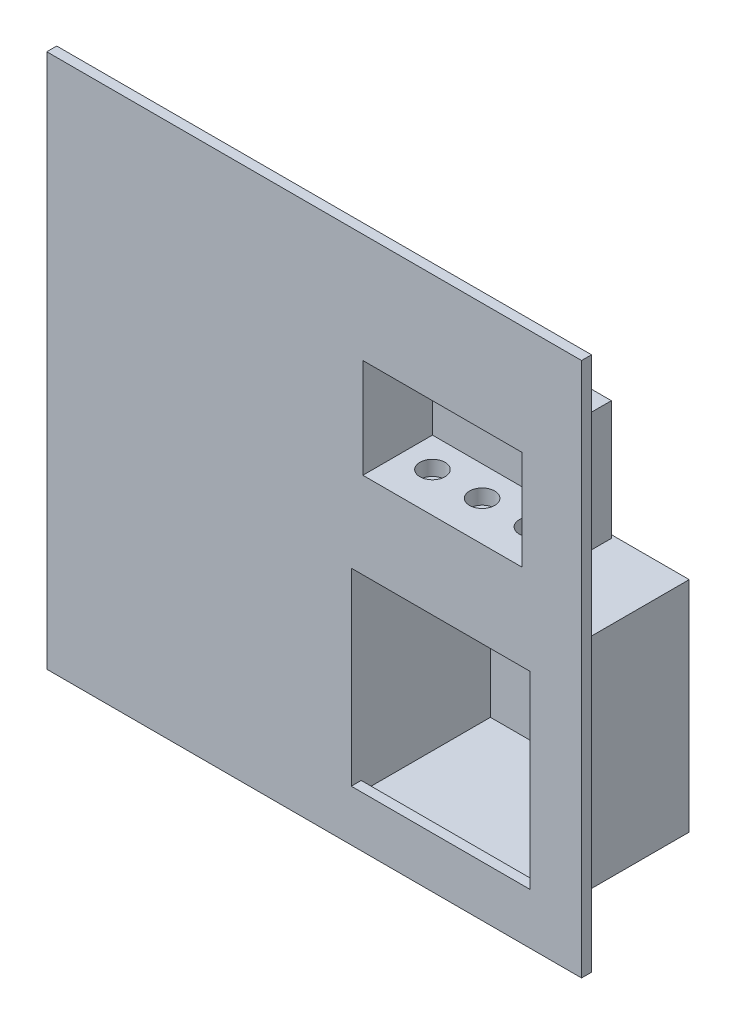
from build123d import *

# Parameters (mm, degrees)
SKETCH1_W           = 683.26
SKETCH1_H           = 683.26
SKETCH1_W_2         = 203.2
SKETCH1_H_2         = 127
BOSS_EXTRUDE1_DEPTH = 12.7
SKETCH2_W           = 203.2
SKETCH2_H           = 76.2
BOSS_EXTRUDE2_DEPTH = 25.4
SKETCH3_R           = 16.0655
CUT_EXTRUDE1_DEPTH  = 19.05
SKETCH4_W           = 12.7
SKETCH4_H           = 12.7
SKETCH4_H_2         = 127
SKETCH4_W_2         = 203.2
BOSS_EXTRUDE4_DEPTH = 76.2
BOSS_EXTRUDE5_DEPTH = 12.7
SKETCH6_W           = 228.6
SKETCH6_H           = 254
CUT_EXTRUDE2_DEPTH  = 972.60229271
SKETCH7_W           = 228.6
SKETCH7_H           = 12.7
BOSS_EXTRUDE6_DEPTH = 177.8
SKETCH8_W           = 12.7
SKETCH8_H           = 279.4
BOSS_EXTRUDE7_DEPTH = 177.8
SKETCH9_W           = 228.6
SKETCH9_H           = 12.7
BOSS_EXTRUDE8_DEPTH = 254
SKETCH10_W          = 228.6
SKETCH10_H          = 12.7
BOSS_EXTRUDE9_DEPTH = 12.7


with BuildPart() as part:
    # Sketch1 → Boss-Extrude1 (new body)
    with BuildSketch(Plane.XY):
        with Locations((341.63, 341.63)):
            Rectangle(SKETCH1_W, SKETCH1_H)
        with Locations((505.46, 480.06)):
            Rectangle(SKETCH1_W_2, SKETCH1_H_2, mode=Mode.SUBTRACT)
    extrude(amount=BOSS_EXTRUDE1_DEPTH)

    # Sketch2 → Boss-Extrude2 (add)
    with BuildSketch(Plane(origin=(0, 416.56, 0), x_dir=(1, 0, 0), z_dir=(0, 1, 0))):
        with Locations((505.46, 38.1)):
            Rectangle(SKETCH2_W, SKETCH2_H)
    extrude(amount=-BOSS_EXTRUDE2_DEPTH)

    # Sketch3 → Cut-Extrude1 (cut)
    with BuildSketch(Plane(origin=(0, 416.56, 0), x_dir=(1, 0, 0), z_dir=(0, 1, 0))):
        with Locations(Location((568.96, 38.1, 0), (0, 0, 270))):
            Circle(SKETCH3_R)
        with Locations(Location((505.46, 38.1, 0), (0, 0, 270))):
            Circle(SKETCH3_R)
        with Locations(Location((441.96, 38.1, 0), (0, 0, 270))):
            Circle(SKETCH3_R)
    extrude(amount=-CUT_EXTRUDE1_DEPTH, mode=Mode.SUBTRACT)

    # Sketch4 → Boss-Extrude4 (add)
    with BuildSketch(Plane(origin=(0, 0, 0), x_dir=(-1, 0, 0), z_dir=(0, 0, -1))):
        with Locations((-613.41, 410.21)):
            Rectangle(SKETCH4_W, SKETCH4_H)
        with Locations((-613.41, 480.06)):
            Rectangle(SKETCH4_W, SKETCH4_H_2)
        with Locations((-505.46, 549.91)):
            Rectangle(SKETCH4_W_2, SKETCH4_H)
        with Locations((-613.41, 549.91)):
            Rectangle(SKETCH4_W, SKETCH4_H)
        with Locations((-397.51, 549.91)):
            Rectangle(SKETCH4_W, SKETCH4_H)
        with Locations((-397.51, 480.06)):
            Rectangle(SKETCH4_W, SKETCH4_H_2)
        with Locations((-397.51, 410.21)):
            Rectangle(SKETCH4_W, SKETCH4_H)
    extrude(amount=BOSS_EXTRUDE4_DEPTH)

    # Sketch5 → Boss-Extrude5 (add)
    with BuildSketch(Plane(origin=(0, 0, -76.2), x_dir=(-1, 0, 0), z_dir=(0, 0, -1))):
        Polygon((-607.06, 391.16), (-403.86, 391.16), (-403.86, 403.86), (-391.16, 403.86), (-391.16, 556.26), (-619.76, 556.26), (-619.76, 403.86), (-607.06, 403.86), align=None)
    extrude(amount=BOSS_EXTRUDE5_DEPTH)

    # Sketch6 → Cut-Extrude2 (cut, through all)
    with BuildSketch(Plane.XY.offset(12.7)):
        with Locations((503.315588228, 179.399098269)):
            Rectangle(SKETCH6_W, SKETCH6_H)
    extrude(amount=-CUT_EXTRUDE2_DEPTH, mode=Mode.SUBTRACT)

    # Sketch7 → Boss-Extrude6 (add)
    with BuildSketch(Plane(origin=(0, 0, 0), x_dir=(-1, 0, 0), z_dir=(0, 0, -1))):
        with Locations((-503.315588228, 46.049098269)):
            Rectangle(SKETCH7_W, SKETCH7_H)
    boss_extrude6 = extrude(amount=BOSS_EXTRUDE6_DEPTH)

    # Mirror1: Boss-Extrude6 across plane
    add(boss_extrude6.mirror(Plane.ZX.offset(179.399098269)))

    # Sketch8 → Boss-Extrude7 (add)
    with BuildSketch(Plane(origin=(0, 0, 0), x_dir=(-1, 0, 0), z_dir=(0, 0, -1))):
        with Locations((-623.965588228, 179.399098269)):
            Rectangle(SKETCH8_W, SKETCH8_H)
        with Locations((-382.665588228, 179.399098269)):
            Rectangle(SKETCH8_W, SKETCH8_H)
    extrude(amount=BOSS_EXTRUDE7_DEPTH)

    # Sketch9 → Boss-Extrude8 (add)
    with BuildSketch(Plane(origin=(0, 52.399098269, 0), x_dir=(1, 0, 0), z_dir=(0, 1, 0))):
        with Locations((503.315588228, 171.45)):
            Rectangle(SKETCH9_W, SKETCH9_H)
    extrude(amount=BOSS_EXTRUDE8_DEPTH)

    # Sketch10 → Boss-Extrude9 (add)
    with BuildSketch(Plane(origin=(0, 52.399098269, 0), x_dir=(1, 0, 0), z_dir=(0, 1, 0))):
        with Locations((503.315588228, -6.35)):
            Rectangle(SKETCH10_W, SKETCH10_H)
    extrude(amount=BOSS_EXTRUDE9_DEPTH)


solid = part.part
